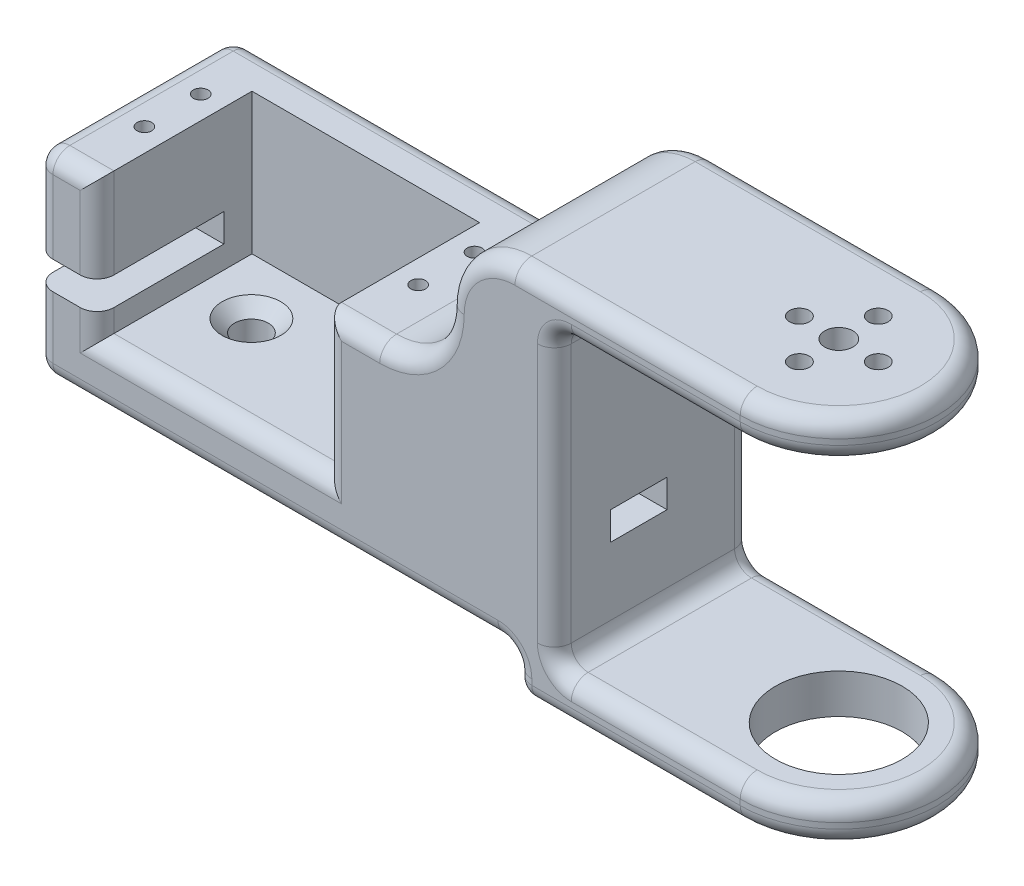
from build123d import *

# Parameters (mm, degrees)
SKETCH1_W               = 85
SKETCH1_H               = 35
BOSS_EXTRUDE1_DEPTH     = 35
SKETCH1_3_W             = 40.4
SKETCH1_3_H             = 20
SKETCH1_3_R             = 3.9
SKETCH1_3_H_2           = 7.5
CUT_EXTRUDE1_DEPTH      = 25
SKETCH1_6_R             = 1.3
CUT_EXTRUDE3_DEPTH      = 10
EXTRUDE_THIN1_DEPTH     = 35
SKETCH3_R               = 17.5
BOSS_EXTRUDE2_DEPTH     = 7
BOSS_EXTRUDE3_START     = -66
SKETCH3_3_R             = 17.5
BOSS_EXTRUDE3_DEPTH     = 7
BOSS_EXTRUDE6_DEPTH     = 35
FILLET3_R               = 3
CUT_EXTRUDE4_REACH      = 141.607
SKETCH4_7_W             = 22.5
SKETCH4_7_H             = 5
SKETCH4_7_W_2           = 3
CUT_EXTRUDE8_DEPTH      = 140.309866497
CUT_EXTRUDE9_START      = -59
CUT_EXTRUDE9_DEPTH      = 2
CUT_EXTRUDE10_REACH     = 139.314
SKETCH5_R               = 2.5
SKETCH5_R_2             = 1.75
CIRPATTERN1_COUNT       = 4
CUT_EXTRUDE_THIN1_START = -10
CUT_EXTRUDE_THIN1_DEPTH = 10


with BuildPart() as part:
    # Sketch1 → Boss-Extrude1 (new body)
    with BuildSketch(Plane(origin=(0, 0, 0), x_dir=(1, 0, 0), z_dir=(0, 1, 0))):
        with Locations((21.77, 0)):
            Rectangle(SKETCH1_W, SKETCH1_H)
    extrude(amount=-BOSS_EXTRUDE1_DEPTH)

    # Sketch1<3> → Cut-Extrude1 (cut)
    # profile 1 of 3: a face of its own
    with BuildSketch(Plane(origin=(0, 0, 0), x_dir=(1, 0, 0), z_dir=(0, 1, 0))):
        with Locations((10.3, 0)):
            Rectangle(SKETCH1_3_W, SKETCH1_3_H)
        Circle(SKETCH1_3_R, mode=Mode.SUBTRACT)
    # profile 2 of 3: a face of its own
    with BuildSketch(Plane(origin=(0, 0, 0), x_dir=(1, 0, 0), z_dir=(0, 1, 0))):
        Circle(SKETCH1_3_R)
    # profile 3 of 3: a face of its own
    with BuildSketch(Plane(origin=(0, 0, 0), x_dir=(1, 0, 0), z_dir=(0, 1, 0))):
        with Locations((10.3, -13.75)):
            Rectangle(SKETCH1_3_W, SKETCH1_3_H_2)
    extrude(amount=-CUT_EXTRUDE1_DEPTH, mode=Mode.SUBTRACT)

    # Sketch1<6> → Cut-Extrude3 (cut)
    with BuildSketch(Plane(origin=(0, 0, 0), x_dir=(1, 0, 0), z_dir=(0, 1, 0))):
        with Locations(Location((-14, 5, 0), (0, 0, 270))):
            Circle(SKETCH1_6_R)
        with Locations(Location((-14, -5, 0), (0, 0, 270))):
            Circle(SKETCH1_6_R)
        with Locations(Location((34.6, 5, 0), (0, 0, 270))):
            Circle(SKETCH1_6_R)
        with Locations(Location((34.6, -5, 0), (0, 0, 270))):
            Circle(SKETCH1_6_R)
    extrude(amount=-CUT_EXTRUDE3_DEPTH, mode=Mode.SUBTRACT)

    # Sketch2 → Extrude-Thin1 (add)
    with BuildSketch(Plane.XY.offset(17.5)):
        Polygon((104.27, 24), (64.27, 24), (64.27, -42), (104.27, -42), (104.27, -35), (71.27, -35), (71.27, 17), (104.27, 17), align=None)
    extrude(amount=-EXTRUDE_THIN1_DEPTH)

    # Sketch3 → Boss-Extrude2 (add)
    with BuildSketch(Plane.XZ.offset(42)):
        with Locations((104.27, 0)):
            Circle(SKETCH3_R)
    extrude(amount=-BOSS_EXTRUDE2_DEPTH)

    # Sketch3<3> → Boss-Extrude3 (add)
    with BuildSketch(Plane.XZ.offset(42).offset(BOSS_EXTRUDE3_START)):
        with Locations((104.27, 0)):
            Circle(SKETCH3_3_R)
    extrude(amount=BOSS_EXTRUDE3_DEPTH)

    # Sketch16 → Boss-Extrude6 (add)
    with BuildSketch(Plane.XY.offset(17.5)):
        with BuildLine():
            ThreePointArc((52.27, 12), (48.755281374, 3.514718626), (40.27, 0))
            Line((40.27, 0), (64.27, 0))
            Line((64.27, 0), (64.27, 24))
            ThreePointArc((64.27, 24), (55.784718626, 20.485281374), (52.27, 12))
        make_face()
    extrude(amount=-BOSS_EXTRUDE6_DEPTH)

    # Fillet3
    fillet3_edges = [part.edges().sort_by_distance(p)[0] for p in [
        (21.77, -35, 17.5),
        (35.385, 0, 17.5),
        (-20.73, -35, 0),
        (-9.9, -12.5, 17.5),
        (10.3, -25, 17.5),
        (30.5, -12.5, 17.5),
        (64.27, -42, 0),
        (84.27, 24, 17.5),
        (64.27, -38.5, 17.5),
        (84.27, -42, 17.5),
        (71.27, -9, -17.5),
        (71.27, 17, 0),
        (71.27, -9, 17.5),
        (87.77, 17, -17.5),
        (87.77, 17, 17.5),
        (87.77, -35, -17.5),
        (71.27, -35, 0),
        (87.77, -35, 17.5),
        (84.27, -42, -17.5),
        (64.27, -38.5, -17.5),
        (84.27, 24, -17.5),
        (21.77, -35, -17.5),
        (-20.73, 0, 0),
        (-15.315, 0, 17.5),
        (9.77, 0, -17.5),
        (121.77, -42, 0),
        (121.77, -35, 0),
        (121.77, 17, 0),
        (121.77, 24, 0),
        (-20.73, -17.5, -17.5),
        (-20.73, -17.5, 17.5),
        (48.755281374, 3.514718626, -17.5),
        (48.755281374, 3.514718626, 17.5),
        (55.784718626, 20.485281374, 17.5),
        (55.784718626, 20.485281374, -17.5),
        (64.27, -35, 0),
    ]]
    fillet(fillet3_edges, radius=FILLET3_R)

    # Sketch3<4> → Cut-Extrude4 (cut, up to next)
    with BuildSketch(Plane.XZ.offset(42), mode=Mode.PRIVATE) as cut_extrude4_sk1:
        with BuildLine():
            Line((104.27, -11.25), (104.27, 11.25))
            ThreePointArc((104.27, 11.25), (93.02, 0), (104.27, -11.25))
        make_face()
    cut_extrude4_tool1 = extrude(cut_extrude4_sk1.sketch, amount=-CUT_EXTRUDE4_REACH, mode=Mode.PRIVATE) & part.part
    # Sketch3<4> → Cut-Extrude4 (cut, up to next)
    with BuildSketch(Plane.XZ.offset(42), mode=Mode.PRIVATE) as cut_extrude4_sk2:
        with BuildLine():
            ThreePointArc((115.52, 0), (112.224951288, 7.954951288), (104.27, 11.25))
            Line((104.27, 11.25), (104.27, -11.25))
            ThreePointArc((104.27, -11.25), (112.224951288, -7.954951288), (115.52, 0))
        make_face()
    cut_extrude4_tool2 = extrude(cut_extrude4_sk2.sketch, amount=-CUT_EXTRUDE4_REACH, mode=Mode.PRIVATE) & part.part
    # Sketch3<4> → Cut-Extrude4 (cut, up to next)
    with BuildSketch(Plane.XZ.offset(42), mode=Mode.PRIVATE) as cut_extrude4_sk3:
        with BuildLine():
            Line((104.27, -11.25), (104.27, 11.25))
            ThreePointArc((104.27, 11.25), (93.02, 0), (104.27, -11.25))
        make_face()
    cut_extrude4_tool3 = extrude(cut_extrude4_sk3.sketch, amount=-CUT_EXTRUDE4_REACH, mode=Mode.PRIVATE) & part.part
    # Sketch3<4> → Cut-Extrude4 (cut, up to next)
    with BuildSketch(Plane.XZ.offset(42), mode=Mode.PRIVATE) as cut_extrude4_sk4:
        with BuildLine():
            ThreePointArc((115.52, 0), (112.224951288, 7.954951288), (104.27, 11.25))
            Line((104.27, 11.25), (104.27, -11.25))
            ThreePointArc((104.27, -11.25), (112.224951288, -7.954951288), (115.52, 0))
        make_face()
    cut_extrude4_tool4 = extrude(cut_extrude4_sk4.sketch, amount=-CUT_EXTRUDE4_REACH, mode=Mode.PRIVATE) & part.part
    add(cut_extrude4_tool1.solids().sort_by_distance((99.495352, -42, 0))[0], mode=Mode.SUBTRACT)
    add(cut_extrude4_tool2.solids().sort_by_distance((109.044648, -42, 0))[0], mode=Mode.SUBTRACT)
    add(cut_extrude4_tool3.solids().sort_by_distance((99.495352, -42, 0))[0], mode=Mode.SUBTRACT)
    add(cut_extrude4_tool4.solids().sort_by_distance((109.044648, -42, 0))[0], mode=Mode.SUBTRACT)

    # Sketch4<7> → Cut-Extrude8 (cut, through all)
    with BuildSketch(Plane(origin=(-9.9, 0, 0), x_dir=(0, 0, -1), z_dir=(1, 0, 0))):
        with Locations((-6.25, -18.5)):
            Rectangle(SKETCH4_7_W, SKETCH4_7_H)
        with Locations((-16, -18.5)):
            Rectangle(SKETCH4_7_W_2, SKETCH4_7_H)
    extrude(amount=-CUT_EXTRUDE8_DEPTH, mode=Mode.SUBTRACT)

    # Sketch3<5> → Cut-Extrude9 (cut)
    with BuildSketch(Plane.XZ.offset(42).offset(CUT_EXTRUDE9_START)):
        with BuildLine():
            Line((104.27, -11.25), (104.27, 11.25))
            ThreePointArc((104.27, 11.25), (93.02, 0), (104.27, -11.25))
        make_face()
        with BuildLine():
            ThreePointArc((115.52, 0), (112.224951288, 7.954951288), (104.27, 11.25))
            Line((104.27, 11.25), (104.27, -11.25))
            ThreePointArc((104.27, -11.25), (112.224951288, -7.954951288), (115.52, 0))
        make_face()
    extrude(amount=-CUT_EXTRUDE9_DEPTH, mode=Mode.SUBTRACT)

    # Sketch5 → Cut-Extrude10 (cut, up to next)
    with BuildSketch(Plane(origin=(0, 19, 0), x_dir=(-1, 0, 0), z_dir=(0, -1, 0)), mode=Mode.PRIVATE) as cut_extrude10_sk1:
        with Locations(Location((-104.27, 0, 0), (0, 0, 180))):
            Circle(SKETCH5_R)
    cut_extrude10_tool1 = extrude(cut_extrude10_sk1.sketch, amount=-CUT_EXTRUDE10_REACH, mode=Mode.PRIVATE) & part.part
    # Sketch5 → Cut-Extrude10 (cut, up to next)
    with BuildSketch(Plane(origin=(0, 19, 0), x_dir=(-1, 0, 0), z_dir=(0, -1, 0)), mode=Mode.PRIVATE) as cut_extrude10_sk2:
        with Locations(Location((-104.27, -7, 0), (0, 0, 180))):
            Circle(SKETCH5_R_2)
    cut_extrude10_tool2 = extrude(cut_extrude10_sk2.sketch, amount=-CUT_EXTRUDE10_REACH, mode=Mode.PRIVATE) & part.part
    cut_extrude10_1 = cut_extrude10_tool1.solids().sort_by_distance((104.27, 19, 0))[0]
    add(cut_extrude10_1, mode=Mode.SUBTRACT)
    cut_extrude10_2 = cut_extrude10_tool2.solids().sort_by_distance((104.27, 19, 7))[0]
    add(cut_extrude10_2, mode=Mode.SUBTRACT)
    cut_extrude10 = cut_extrude10_1 + cut_extrude10_2  # Cut-Extrude10 as one shape, for the pattern or mirror that repeats it

    # CirPattern1: Cut-Extrude10 ×4 about axis
    cirpattern1_axis = Axis((104.27, 0, 0), (0, 1, 0))
    for i in range(1, CIRPATTERN1_COUNT):
        add(cut_extrude10.rotate(cirpattern1_axis, i * 360 / CIRPATTERN1_COUNT), mode=Mode.SUBTRACT)

    # Sketch9 → CSK for M5 Flat Head Machine Screw1 (revolve, cut)
    with BuildSketch(Plane(origin=(0, -25, 0), x_dir=(0, 0, 1), z_dir=(1, 0, 0))):
        Polygon((0, 0), (0, 17), (3, 17), (3, 2.2), (5.2, 0), align=None)
    revolve(axis=Axis((0, -18.65, 0), (0, -1, 0)), mode=Mode.SUBTRACT)

    # Sketch11 → Cut-Extrude-Thin1 (cut)
    with BuildSketch(Plane.XY.offset(17.5).offset(CUT_EXTRUDE_THIN1_START)):
        with BuildLine():
            Line((71.27, -20), (48.27, -20))
            ThreePointArc((48.27, -20), (42.613145751, -22.343145751), (40.27, -28))
            Line((40.27, -28), (40.27, -35))
            Line((40.27, -35), (35.27, -35))
            Line((35.27, -35), (35.27, -28))
            ThreePointArc((35.27, -28), (39.077611845, -18.807611845), (48.27, -15))
            Line((48.27, -15), (71.27, -15))
            Line((71.27, -15), (71.27, -20))
        make_face()
    extrude(amount=-CUT_EXTRUDE_THIN1_DEPTH, mode=Mode.SUBTRACT)


solid = part.part
